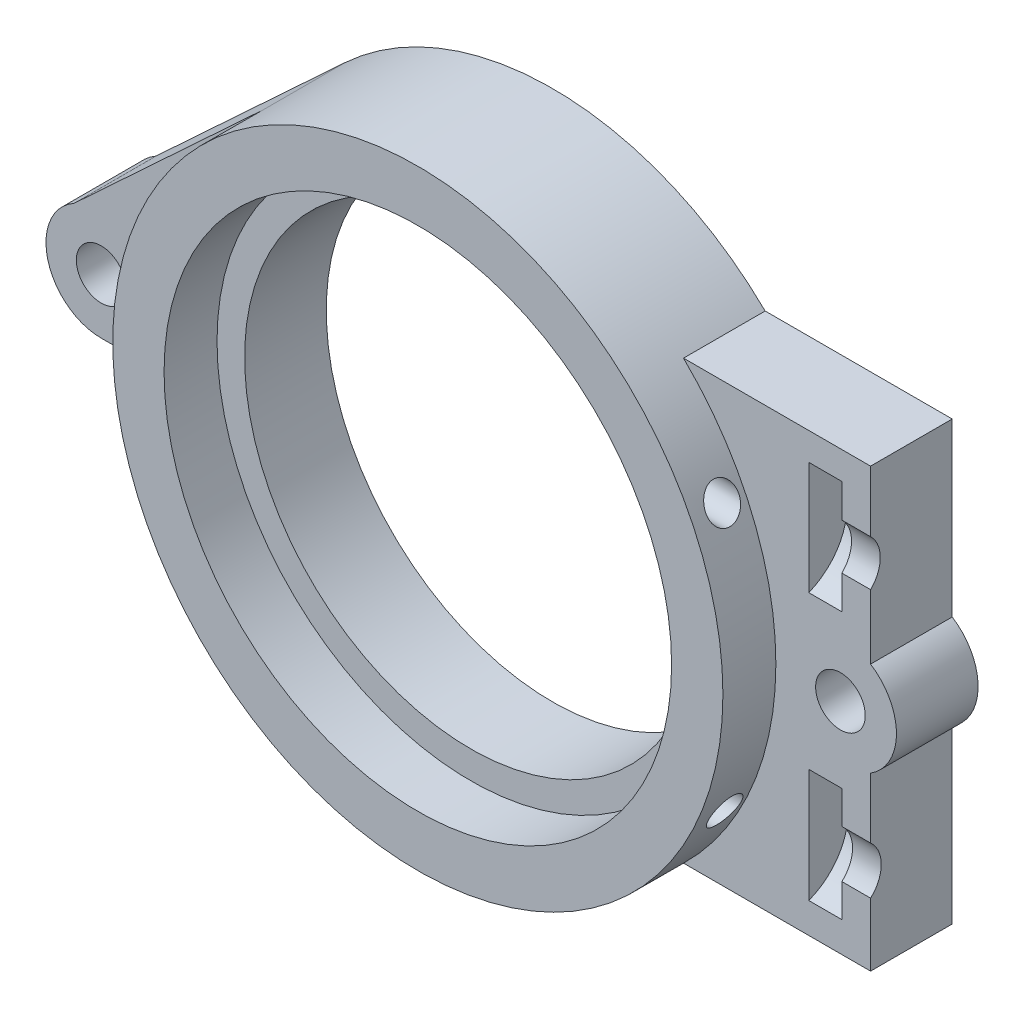
from build123d import *

# Parameters (mm, degrees)
CROQUIS1_R                 = 2.25
SALIENTE_EXTRUIR1_DEPTH    = 7.4
CROQUIS4_R                 = 5.5
CORTAR_EXTRUIR2_DEPTH      = 3
CROQUIS5_R                 = 2.9
CORTAR_EXTRUIR3_DEPTH      = 4
CROQUIS2_R                 = 20.5
CORTAR_EXTRUIR1_DEPTH      = 49.036098674
CROQUIS3_R                 = 27.65
CROQUIS3_R_2               = 23
SALIENTE_EXTRUIR2_DEPTH    = 4.8
CORTAR_EXTRUIR4_DEPTH      = 20
CORTAR_EXTRUIR4_DEPTH_BACK = 9
CROQUIS6_R                 = 1.5


with BuildPart() as part:
    # Croquis1 → Saliente-Extruir1 (new body)
    with BuildSketch(Plane.XY):
        with BuildLine():
            Line((-35.955174002, 4.355699785), (-18.80791724, 20.267825466))
            ThreePointArc((-18.80791724, 20.267825466), (0.325119352, 27.648088495), (19.279317337, 19.819950126))
            Line((19.279317337, 19.819950126), (36.231616172, 19.819950126))
            Line((36.231616172, 19.819950126), (36.231616172, 4.279499518))
            ThreePointArc((36.231616172, 4.279499518), (38.576991534, 0), (36.231616172, -4.279499518))
            Line((36.231616172, -4.279499518), (36.231616172, -19.819950126))
            Line((36.231616172, -19.819950126), (19.279317337, -19.819950126))
            ThreePointArc((19.279317337, -19.819950126), (-8.400531281, -26.34299858), (-27.194162977, -5))
            Line((-27.194162977, -5), (-33.5, -5))
            ThreePointArc((-33.5, -5), (-38.336243321, -1.269153473), (-35.955174002, 4.355699785))
        make_face()
        with Locations((-33.5, 0)):
            Circle(CROQUIS1_R, mode=Mode.SUBTRACT)
        with Locations((33.5, 0)):
            Circle(CROQUIS1_R, mode=Mode.SUBTRACT)
    extrude(amount=SALIENTE_EXTRUIR1_DEPTH)

    # Croquis4 → Cortar-Extruir2 (cut)
    with BuildSketch(Plane(origin=(33.631616172, 0, 0), x_dir=(0, -0.9996578345310084, -0.026157481927263488), z_dir=(1, 0, 0))):
        with Locations((-12.445697835, -9.09891785)):
            Circle(CROQUIS4_R)
        with Locations((11.67759578, -9.64152027)):
            Circle(CROQUIS4_R)
    extrude(amount=-CORTAR_EXTRUIR2_DEPTH, mode=Mode.SUBTRACT)

    # Croquis5 → Cortar-Extruir3 (cut)
    with BuildSketch(Plane(origin=(36.231616172, 0, 0), x_dir=(0, -1, 0), z_dir=(-1, 0, 0))):
        with Locations((-12.203434568, 9.42135263)):
            Circle(CROQUIS5_R)
        with Locations((11.925798003, 9.332764774)):
            Circle(CROQUIS5_R)
    extrude(amount=CORTAR_EXTRUIR3_DEPTH, mode=Mode.SUBTRACT)

    # Croquis2 → Cortar-Extruir1 (cut, through all)
    with BuildSketch(Plane.XY.offset(7.4)):
        Circle(CROQUIS2_R)
    extrude(amount=-CORTAR_EXTRUIR1_DEPTH, mode=Mode.SUBTRACT)

    # Croquis3 → Saliente-Extruir2 (add)
    with BuildSketch(Plane.XY.offset(7.4)):
        with Locations(Location((0, 0, 0), (0, 0, 190.41821508))):
            Circle(CROQUIS3_R)
        Circle(CROQUIS3_R_2, mode=Mode.SUBTRACT)
    extrude(amount=SALIENTE_EXTRUIR2_DEPTH)

    # Croquis6 → Cortar-Extruir4 (cut, two sides: drawn at the far end of the back side and taken through both)
    with BuildSketch(Plane(origin=(26.031616172, 0, 0), x_dir=(0, -1, 0), z_dir=(-1, 0, 0)).offset(-CORTAR_EXTRUIR4_DEPTH_BACK)):
        with Locations(Location((-12.203434568, 9.42135263, 0), (0, 0, 180))):
            Circle(CROQUIS6_R)
        with Locations(Location((11.925798003, 9.332764774, 0), (0, 0, 180))):
            Circle(CROQUIS6_R)
    extrude(amount=CORTAR_EXTRUIR4_DEPTH + CORTAR_EXTRUIR4_DEPTH_BACK, mode=Mode.SUBTRACT)


solid = part.part
